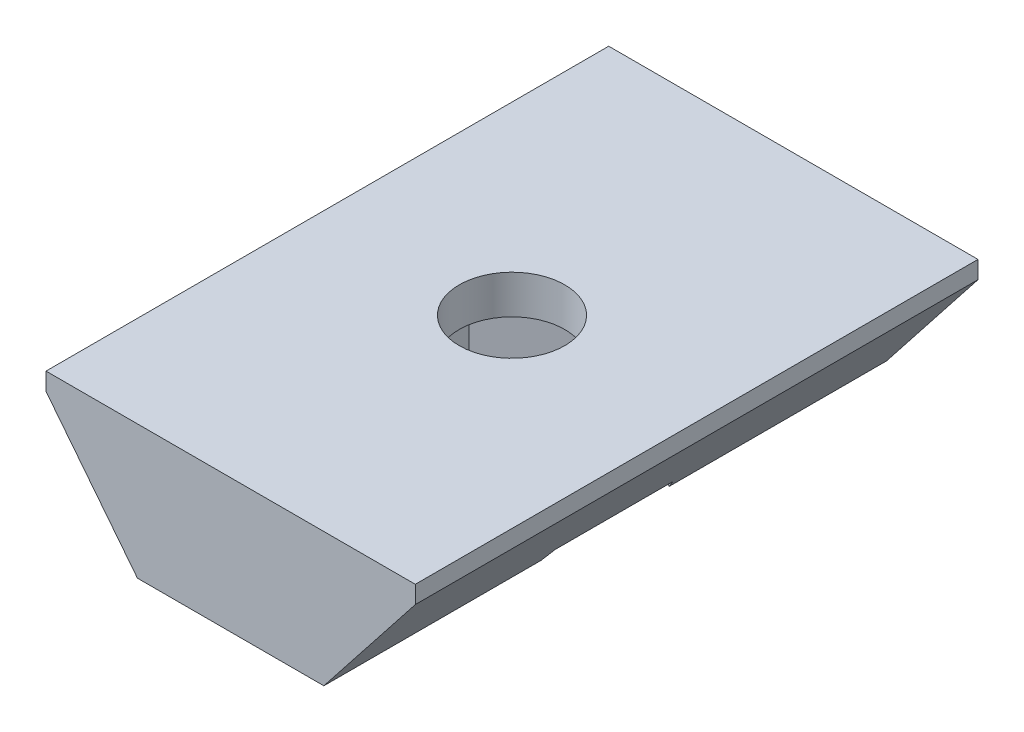
from build123d import *

# Parameters (mm, degrees)
RESSALTO_EXTRUS_O1_DEPTH   = 16
CORTE_EXTRUS_O1_DEPTH      = 18.262748912
CORTE_EXTRUS_O1_DEPTH_BACK = 18.262748912
ESBO_O2_R                  = 1.5
CORTE_EXTRUS_O2_DEPTH      = 2.7


with BuildPart() as part:
    # Esboço1 → Ressalto-extrusão1 (new body)
    with BuildSketch(Plane.XY):
        Polygon((-2.65, 0), (2.65, 0), (5.25, 3.3), (5.25, 3.8), (-5.25, 3.8), (-5.25, 3.3), align=None)
    extrude(amount=RESSALTO_EXTRUS_O1_DEPTH)

    # Esboço2 → Corte-extrusão1 (cut, two sides: drawn at the far end of the back side and taken through both)
    with BuildSketch(Plane(origin=(0, 3.8, 0), x_dir=(1, 0, 0), z_dir=(0, 1, 0)).offset(-CORTE_EXTRUS_O1_DEPTH_BACK)):
        with Locations(Location((0, -8, 0), (0, 0, 270))):
            Circle(ESBO_O2_R)
    extrude(amount=CORTE_EXTRUS_O1_DEPTH + CORTE_EXTRUS_O1_DEPTH_BACK, mode=Mode.SUBTRACT)

    # Esboço3 → Corte-extrusão2 (cut)
    with BuildSketch(Plane.XZ):
        Polygon((0, 11.348631561), (-2.9, 9.674315781), (-2.9, 6.325684219), (0, 4.651368439), (2.9, 6.325684219), (2.9, 9.674315781), align=None)
    extrude(amount=-CORTE_EXTRUS_O2_DEPTH, mode=Mode.SUBTRACT)


solid = part.part
